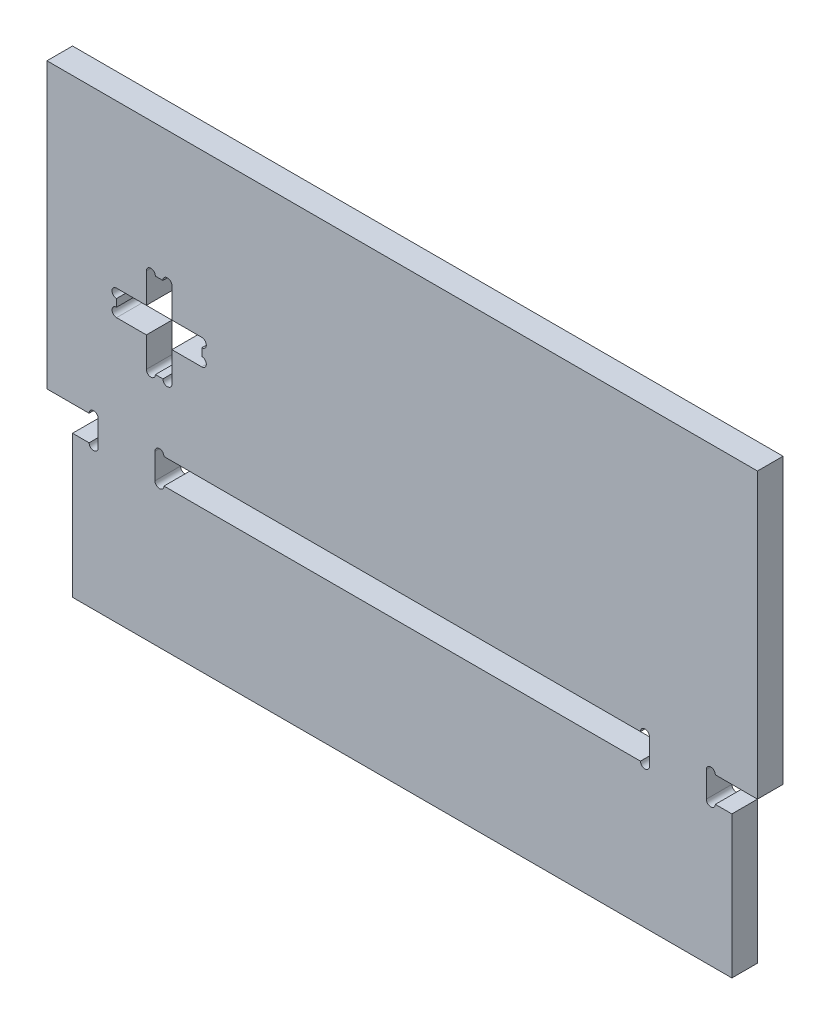
from build123d import *

# Parameters (mm, degrees)
ESTRUSIONE_ESTRUSIONE1_DEPTH = 18
TAGLIO_ESTRUSIONE3_DEPTH     = 61
TAGLIO_ESTRUSIONE5_DEPTH     = 100


with BuildPart() as part:
    # Schizzo1 → Estrusione-Estrusione1 (new body)
    with BuildSketch(Plane.XY):
        with BuildLine():
            Line((-452.35, 100), (-464, 100))
            Line((-464, 100), (-464, 0))
            Line((-464, 0), (0, 0))
            Line((0, 0), (0, 100))
            Line((0, 100), (-11.650000002, 100))
            ThreePointArc((-11.650000002, 100), (-14.825000002, 96.825), (-18.000000001, 100))
            Line((-18.000000001, 100), (-18.000000001, 118.000682307))
            ThreePointArc((-18.000000001, 118.000682307), (-14.824658921, 121.174999982), (-11.650000075, 118))
            Line((-11.650000075, 118), (18, 118))
            Line((18, 118), (18, 318))
            Line((18, 318), (-482, 318))
            Line((-482, 318), (-482, 118))
            Line((-482, 118), (-452.35, 118))
            ThreePointArc((-452.35, 118), (-449.175, 121.175), (-446, 118))
            Line((-446, 118), (-446, 100))
            ThreePointArc((-446, 100), (-449.175, 96.825), (-452.35, 100))
        make_face()
    extrude(amount=ESTRUSIONE_ESTRUSIONE1_DEPTH)

    # Schizzo1<6> → Taglio-Estrusione3 (cut)
    with BuildSketch(Plane.XY):
        with BuildLine():
            Line((-399.65, 118), (-64.349999981, 118))
            ThreePointArc((-64.349999981, 118), (-61.175172814, 121.174999995), (-58, 118.000345666))
            Line((-58, 118.000345666), (-58, 100.000682304))
            ThreePointArc((-58, 100.000682304), (-61.174658811, 96.825341189), (-64.349999927, 100))
            Line((-64.349999927, 100), (-399.65, 100))
            ThreePointArc((-399.65, 100), (-402.825, 96.825), (-406, 100))
            Line((-406, 100), (-406, 118))
            ThreePointArc((-406, 118), (-402.825, 121.175), (-399.65, 118))
        make_face()
    extrude(amount=TAGLIO_ESTRUSIONE3_DEPTH, mode=Mode.SUBTRACT)

    # Schizzo1<8> → Taglio-Estrusione5 (cut)
    with BuildSketch(Plane.XY):
        with BuildLine():
            Line((-412.05, 185.92), (-433.05, 185.92))
            ThreePointArc((-433.05, 185.92), (-436.225, 189.095), (-433.05, 192.27))
            Line((-433.05, 192.27), (-433.05, 197.57))
            ThreePointArc((-433.05, 197.57), (-436.225, 200.745), (-433.05, 203.92))
            Line((-433.05, 203.92), (-412.05, 203.92))
            Line((-412.05, 203.92), (-412.05, 224.92))
            ThreePointArc((-412.05, 224.92), (-408.875, 228.095), (-405.7, 224.92))
            Line((-405.7, 224.92), (-400.4, 224.92))
            ThreePointArc((-400.4, 224.92), (-397.225, 228.095), (-394.05, 224.92))
            Line((-394.05, 224.92), (-394.05, 203.92))
            Line((-394.05, 203.92), (-373.05, 203.92))
            ThreePointArc((-373.05, 203.92), (-369.875, 200.745), (-373.05, 197.57))
            Line((-373.05, 197.57), (-373.05, 192.27))
            ThreePointArc((-373.05, 192.27), (-369.875, 189.095), (-373.05, 185.92))
            Line((-373.05, 185.92), (-394.05, 185.92))
            Line((-394.05, 185.92), (-394.05, 164.92))
            ThreePointArc((-394.05, 164.92), (-397.225, 161.745), (-400.4, 164.92))
            Line((-400.4, 164.92), (-405.7, 164.92))
            ThreePointArc((-405.7, 164.92), (-408.875, 161.745), (-412.05, 164.92))
            Line((-412.05, 164.92), (-412.05, 185.92))
        make_face()
    extrude(amount=TAGLIO_ESTRUSIONE5_DEPTH, mode=Mode.SUBTRACT)


solid = part.part
